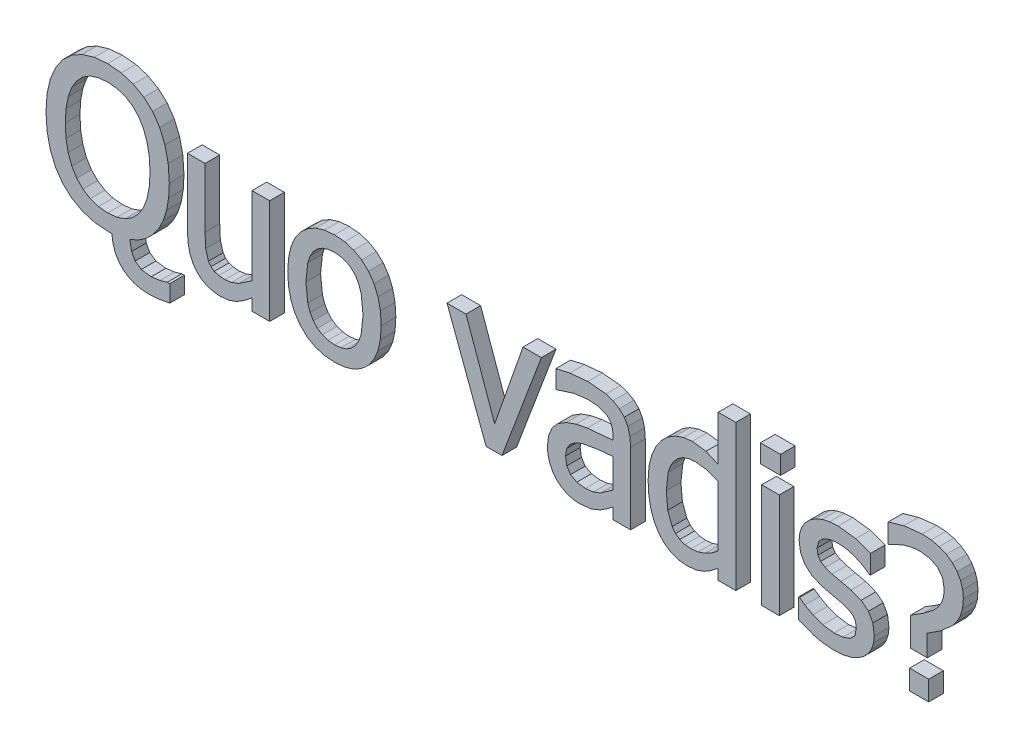
from build123d import *

# Parameters (mm, degrees)
BOSS_EXTRUDE2_DEPTH  = 21.945601329
BOSS_EXTRUDE3_DEPTH  = 21.945601329
BOSS_EXTRUDE4_DEPTH  = 21.945601329
BOSS_EXTRUDE5_DEPTH  = 21.945601329
BOSS_EXTRUDE6_DEPTH  = 21.945601329
BOSS_EXTRUDE7_DEPTH  = 21.945601329
BOSS_EXTRUDE8_DEPTH  = 21.945601329
BOSS_EXTRUDE9_DEPTH  = 21.945601329
SKETCH45_W           = 29.989480972
SKETCH45_H           = 27.32694149
BOSS_EXTRUDE10_DEPTH = 21.945601329
SKETCH50_W           = 26.345968246
SKETCH50_H           = 156.534194946
BOSS_EXTRUDE11_DEPTH = 21.945601329
SKETCH55_W           = 28.588294983
SKETCH55_H           = 29.569149017
BOSS_EXTRUDE12_DEPTH = 21.945601329


with BuildPart() as part:
    # Sketch5 → Boss-Extrude2 (new body)
    with BuildSketch(Plane.XY.offset(21.945601329)):
        Polygon((3032.252550125, 1582.424879074), (3031.341552734, 1603.095293045), (3031.341552734, 1692.223072052), (3004.995346069, 1692.223072052), (3004.995346069, 1590.623021126), (3005.923986435, 1575.978517532), (3008.709192276, 1563.7165308), (3013.175964355, 1553.591609001), (3019.149541855, 1545.358419418), (3026.454210281, 1539.052248001), (3034.914970398, 1534.707903862), (3044.251680374, 1532.185554504), (3054.183959961, 1531.344771385), (3067.006587982, 1532.728552818), (3078.568220139, 1536.880135536), (3089.814186096, 1543.694257736), (3101.690769196, 1553.066134453), (3101.690769196, 1535.688877106), (3128.036737442, 1535.688877106), (3128.036737442, 1692.223072052), (3101.690769196, 1692.223072052), (3101.690769196, 1575.3480196), (3081.650972366, 1561.894655228), (3071.035385132, 1557.795763016), (3061.050653458, 1556.429386139), (3051.889419556, 1557.130098343), (3045.14503479, 1559.232234955), (3040.187597275, 1562.84070015), (3036.386489868, 1568.06075573), align=None)
    extrude(amount=-BOSS_EXTRUDE2_DEPTH)


with BuildPart() as body_2:
    # Sketch10 → Boss-Extrude3 (new body)
    with BuildSketch(Plane.XY.offset(21.945601329)):
        Polygon((2865.330457687, 1533.289074898), (2885.457754135, 1531.4848423), (2891.904354095, 1531.4848423), (2893.432617188, 1519.993424416), (2896.616458893, 1509.903550148), (2901.455402374, 1501.215100288), (2907.950162888, 1493.927955627), (2915.819644928, 1488.164663315), (2924.784183502, 1484.048128128), (2934.843540192, 1481.578230858), (2945.997714996, 1480.754852295), (2962.603807449, 1481.735825539), (2978.509426117, 1484.67874527), (2978.509426117, 1509.903550148), (2974.725723267, 1509.903550148), (2963.794946671, 1506.750464439), (2950.621843338, 1504.998803139), (2935.837507248, 1507.030844688), (2926.658391953, 1513.406991959), (2921.403169632, 1523.286700249), (2918.670654297, 1537.370562553), (2931.677341461, 1543.125033379), (2943.229675293, 1550.999045372), (2953.328609467, 1560.992598534), (2961.973190308, 1573.105812073), (2968.901395798, 1587.163448334), (2973.849773407, 1602.990269661), (2976.819038391, 1620.586276054), (2977.808952332, 1639.951586723), (2976.162195206, 1664.580821991), (2971.222162247, 1686.33723259), (2963.304519653, 1705.010652542), (2952.72397995, 1720.390796661), (2939.621210098, 1732.337474823), (2923.855543137, 1741.27137661), (2905.707597733, 1746.841788292), (2885.457754135, 1748.698592186), (2865.435838699, 1746.894359589), (2847.410678864, 1741.481423378), (2831.627607346, 1732.600212097), (2818.331956863, 1720.390796661), (2807.663917542, 1704.695224762), (2799.763441086, 1686.197042465), (2794.876098633, 1664.685964584), (2793.246984482, 1639.951586723), (2794.858694077, 1615.637660027), (2799.693584442, 1593.986392021), (2807.541131973, 1575.277805328), (2818.191766739, 1559.792637825), (2831.487417221, 1547.58310318), (2847.27025032, 1538.701891899), align=None)
        Polygon((2885.598182678, 1555.168151855), (2871.829509735, 1556.534409523), (2859.532356262, 1560.633540154), (2848.70672226, 1567.465186119), (2839.352369308, 1577.029705048), (2831.811189651, 1589.160323143), (2826.424837112, 1603.690981865), (2823.192834854, 1620.621323586), (2822.115421295, 1639.951586723), (2823.219060898, 1659.220576286), (2826.529741287, 1676.387429237), (2831.907749176, 1691.136956215), (2839.212417603, 1703.153848648), (2848.549127579, 1712.770700455), (2859.18211937, 1719.479799271), (2871.426582336, 1723.421216011), (2885.598182678, 1724.734902382), (2899.454116821, 1723.386287689), (2911.873817444, 1719.339728355), (2922.717094421, 1712.595462799), (2931.843519211, 1703.153848648), (2939.060688019, 1691.277146339), (2944.455862045, 1676.667809486), (2947.819232941, 1659.500837326), (2948.940515518, 1639.951586723), (2947.867393494, 1620.621323586), (2944.648742676, 1603.690981865), (2939.284086227, 1589.160323143), (2931.773424149, 1577.029705048), (2922.450065613, 1567.465186119), (2911.646127701, 1560.633540154), (2899.36208725, 1556.534409523), align=None, mode=Mode.SUBTRACT)
    extrude(amount=-BOSS_EXTRUDE3_DEPTH)


with BuildPart() as body_3:
    # Sketch15 → Boss-Extrude4 (new body)
    with BuildSketch(Plane.XY.offset(21.945601329)):
        Polygon((3265.564680099, 1543.444633484), (3275.88224411, 1552.855849266), (3284.220218658, 1564.736962318), (3290.176391602, 1578.868985176), (3293.749809265, 1595.251917839), (3294.940710068, 1613.885998726), (3293.749809265, 1632.467389107), (3290.176391602, 1648.832798004), (3284.220218658, 1662.982344627), (3275.88224411, 1674.915909767), (3265.564680099, 1684.388399124), (3253.670454025, 1691.15447998), (3240.199565887, 1695.214033127), (3225.152254105, 1696.567177773), (3210.153102875, 1695.209622383), (3196.68674469, 1691.136956215), (3184.75317955, 1684.349060059), (3174.352169037, 1674.845933914), (3165.921926498, 1662.890434265), (3159.900426865, 1648.745298386), (3156.287431717, 1632.410407066), (3155.083417892, 1613.885998726), (3156.252384186, 1595.821261406), (3159.760475159, 1579.744815826), (3165.606737137, 1565.656542778), (3173.791885376, 1553.55656147), (3184.017419815, 1543.838858604), (3195.986032486, 1536.897540092), (3209.69748497, 1532.732963562), (3225.152254105, 1531.344771385), (3240.199565887, 1532.689213753), (3253.670454025, 1536.722421646), align=None)
        Polygon((3264.986515045, 1640.389561653), (3267.75431633, 1613.885998726), (3264.96887207, 1587.662696838), (3261.487483978, 1577.375650406), (3256.613254547, 1568.97175312), (3250.468969345, 1562.442183495), (3243.17741394, 1557.778120041), (3234.738349915, 1554.979801178), (3225.152254105, 1554.047107697), (3215.443372726, 1554.997444153), (3206.916809082, 1557.848215103), (3199.57280159, 1562.599778175), (3193.410873413, 1569.25201416), (3188.536643982, 1577.743530273), (3185.05525589, 1588.01305294), (3182.26981163, 1613.885998726), (3185.05525589, 1640.389561653), (3188.536643982, 1650.711536407), (3193.410873413, 1659.080386162), (3199.57280159, 1665.548682213), (3206.916809082, 1670.168757439), (3215.443372726, 1672.940969467), (3225.152254105, 1673.864841461), (3234.795570374, 1672.940969467), (3243.265151978, 1670.168757439), (3250.560998917, 1665.548682213), (3256.683349609, 1659.080386162), (3261.526823044, 1650.711536407), align=None, mode=Mode.SUBTRACT)
    extrude(amount=-BOSS_EXTRUDE4_DEPTH)


with BuildPart() as body_4:
    # Sketch20 → Boss-Extrude5 (new body)
    with BuildSketch(Plane.XY.offset(21.945601329)):
        Polygon((3393.457889557, 1692.223072052), (3452.035427094, 1535.688877106), (3475.718975067, 1535.688877106), (3534.716844559, 1692.223072052), (3507.249832153, 1692.223072052), (3464.788198471, 1571.424126625), (3421.905755997, 1692.223072052), align=None)
    extrude(amount=-BOSS_EXTRUDE5_DEPTH)


with BuildPart() as body_5:
    # Sketch25 → Boss-Extrude6 (new body)
    with BuildSketch(Plane.XY.offset(21.945601329)):
        Polygon((3642.062664032, 1535.688877106), (3668.268442154, 1535.688877106), (3668.268442154, 1642.75431633), (3667.217493057, 1656.347632408), (3664.064407349, 1667.698860168), (3658.774137497, 1676.982998848), (3651.311635971, 1684.375286102), (3641.922235489, 1689.945816994), (3631.412029266, 1693.484306335), (3604.22539711, 1696.006774902), (3577.318668365, 1693.484306335), (3556.438207626, 1688.859701157), (3556.438207626, 1662.093400955), (3557.979822159, 1662.093400955), (3582.643985748, 1670.011162758), (3604.084968567, 1672.743797302), (3619.079828262, 1671.692848206), (3631.412029266, 1667.418718338), (3635.896682739, 1663.687467575), (3639.260053635, 1658.659934998), (3641.361951828, 1652.091026306), (3642.062664032, 1643.735408783), (3642.062664032, 1638.69035244), (3603.384494781, 1635.257005692), (3586.638212204, 1632.016301155), (3572.27396965, 1626.918792725), (3559.416294098, 1619.018435478), (3550.552368164, 1608.770847321), (3545.402526855, 1596.140861511), (3543.685913086, 1581.093549728), (3544.631719589, 1570.84608078), (3547.469377518, 1561.123967171), (3551.883935928, 1552.417874336), (3557.559490204, 1545.218348503), (3564.671278, 1539.367556572), (3572.83449173, 1534.988284111), (3581.768274307, 1532.255530357), (3591.192722321, 1531.344771385), (3609.480619431, 1533.306598663), (3623.003959656, 1538.912177086), (3633.444309235, 1545.70877552), (3642.062664032, 1552.365422249), align=None)
        Polygon((3587.759017944, 1557.305335999), (3578.439950943, 1562.455296516), (3572.764396667, 1570.96862793), (3570.872545242, 1582.775235176), (3572.589159012, 1593.373298645), (3577.739238739, 1601.343512535), (3585.516929626, 1607.14173317), (3595.116376877, 1611.223340034), (3618.309259415, 1615.357398987), (3642.062664032, 1617.669701576), (3642.062664032, 1574.226856232), (3623.143911362, 1560.983896255), (3612.458467484, 1556.937456131), (3600.581645966, 1555.58848381), align=None, mode=Mode.SUBTRACT)
    extrude(amount=-BOSS_EXTRUDE6_DEPTH)


with BuildPart() as body_6:
    # Sketch30 → Boss-Extrude7 (new body)
    with BuildSketch(Plane.XY.offset(21.945601329)):
        Polygon((4015.232086182, 1663.634896278), (4025.900363922, 1656.487941742), (4027.30178833, 1656.487941742), (4027.30178833, 1684.655666351), (4005.159854889, 1692.783474922), (3978.954076767, 1696.006774902), (3966.368198395, 1695.174694061), (3955.095767975, 1692.678570747), (3945.137023926, 1688.518047333), (3936.492204666, 1682.693600655), (3929.50296402, 1675.546526909), (3924.510478973, 1667.418718338), (3921.515226364, 1658.309578896), (3920.516729355, 1648.219704628), (3922.548532486, 1633.943200111), (3928.644657135, 1621.943831444), (3939.225196838, 1612.502098083), (3954.710483551, 1605.898141861), (3969.705104828, 1602.254509926), (3982.87820816, 1599.311470985), (3993.931293488, 1595.703005791), (4001.026153564, 1591.32373333), (4004.861831665, 1585.402846336), (4006.14118576, 1577.169775963), (4003.968715668, 1566.238999367), (3996.891736984, 1559.37230587), (3986.241340637, 1555.658578873), (3972.788095474, 1554.187178612), (3956.041574478, 1556.569576263), (3941.256999969, 1562.034964561), (3929.135084152, 1568.761467934), (3921.217441559, 1574.647426605), (3919.816017151, 1574.647426605), (3919.816017151, 1545.078277588), (3942.448139191, 1536.10932827), (3956.619501114, 1532.956242561), (3971.80724144, 1531.905174255), (3986.433982849, 1532.816171646), (3998.363256454, 1535.54880619), (4008.400440216, 1540.033221245), (4017.352104187, 1546.199321747), (4024.131298065, 1553.293704987), (4029.053211212, 1561.684608459), (4032.049179077, 1570.986151695), (4033.047676086, 1580.813407898), (4030.858039856, 1596.368670464), (4024.289131165, 1608.280301094), (4013.375759125, 1616.933941841), (3998.152971268, 1622.71463871), (3982.948064804, 1626.148104668), (3969.845294952, 1629.160881042), (3959.685087204, 1632.681846619), (3952.748298645, 1637.078762054), (3948.754549026, 1643.157243729), (3947.422981262, 1651.723146439), (3949.665307999, 1661.392688751), (3956.391811371, 1668.259382248), (3966.376543045, 1672.358512878), (3978.393554688, 1673.724770546), (3990.953445435, 1672.568678856), (4003.408432007, 1669.100284576), align=None)
    extrude(amount=-BOSS_EXTRUDE7_DEPTH)


with BuildPart() as body_7:
    # Sketch35 → Boss-Extrude8 (new body)
    with BuildSketch(Plane.XY.offset(21.945601329)):
        Polygon((4053.787708282, 1710.160732269), (4055.329322815, 1710.160732269), (4075.438976288, 1719.900250435), (4088.244438171, 1723.421216011), (4101.855278015, 1724.594831467), (4116.324424744, 1722.650408745), (4127.780914307, 1716.817140579), (4135.242938995, 1707.025170326), (4137.73059845, 1693.204045296), (4136.679172516, 1682.991504669), (4133.526325226, 1673.935055733), (4128.481388092, 1665.789484978), (4121.754646301, 1658.309578896), (4105.428695679, 1645.907402039), (4087.141036987, 1634.486198425), (4087.141036987, 1591.744065285), (4112.225532532, 1591.744065285), (4112.225532532, 1623.695492744), (4132.475376129, 1637.008666992), (4149.641990662, 1652.003526688), (4156.45647049, 1660.779595375), (4161.764144897, 1670.852065086), (4165.180206299, 1682.325720787), (4166.318893433, 1695.306062698), (4165.285110474, 1706.705451012), (4162.184238434, 1716.939806938), (4157.01675415, 1726.009368896), (4149.782180786, 1733.914017677), (4140.752315521, 1740.321040154), (4130.198001862, 1744.89736557), (4118.119716644, 1747.643113136), (4104.517936707, 1748.558521271), (4077.470779419, 1745.545506477), (4053.787708282, 1738.748788834), align=None)
    extrude(amount=-BOSS_EXTRUDE8_DEPTH)


with BuildPart() as body_8:
    # Sketch40 → Boss-Extrude9 (new body)
    with BuildSketch(Plane.XY.offset(21.945601329)):
        Polygon((3766.6451931, 1532.816171646), (3778.2766819, 1536.950230598), (3788.786888123, 1543.1163311), (3799.437522888, 1551.664710045), (3799.437522888, 1535.688877106), (3825.783491135, 1535.688877106), (3825.783491135, 1753.743648529), (3799.437522888, 1753.743648529), (3799.437522888, 1685.916781425), (3781.079292297, 1693.974733353), (3760.619163513, 1696.567177773), (3747.604131699, 1695.113420486), (3735.184431076, 1690.751671791), (3723.955631256, 1683.832287788), (3714.513778687, 1674.705862999), (3706.140756607, 1662.531256676), (3699.799537659, 1648.429870605), (3695.805311203, 1631.981253624), (3694.474220276, 1612.764835358), (3695.525169373, 1594.143986702), (3698.678255081, 1577.800393105), (3703.758239746, 1563.804149628), (3710.589885712, 1552.225232124), (3718.980789185, 1543.221473694), (3729.018211365, 1536.669969559), (3740.351915359, 1532.675981522), (3752.631425858, 1531.344771385), align=None)
        Polygon((3789.873123169, 1566.642045975), (3779.678106308, 1561.123967171), (3769.202470779, 1557.603001595), (3758.797645569, 1556.429386139), (3749.723434448, 1557.344675064), (3741.980791092, 1560.09054184), (3735.5697155, 1564.666867256), (3730.489492416, 1571.073770523), (3723.868131638, 1588.958859444), (3721.661090851, 1613.325357437), (3724.53379631, 1638.672828674), (3728.12461853, 1648.810863495), (3733.152151108, 1657.258629799), (3739.449739456, 1663.910865784), (3746.85049057, 1668.662428856), (3755.355119705, 1671.513199806), (3764.963626862, 1672.463536263), (3781.850337982, 1670.6417799), (3799.437522888, 1664.055347443), (3799.437522888, 1573.806405067), align=None, mode=Mode.SUBTRACT)
    extrude(amount=-BOSS_EXTRUDE9_DEPTH)


with BuildPart() as body_9:
    # Sketch45 → Boss-Extrude10 (new body)
    with BuildSketch(Plane.XY.offset(21.945601329)):
        with Locations((3877.63440609, 1732.092320919)):
            Rectangle(SKETCH45_W, SKETCH45_H)
    extrude(amount=-BOSS_EXTRUDE10_DEPTH)


with BuildPart() as body_10:
    # Sketch50 → Boss-Extrude11 (new body)
    with BuildSketch(Plane.XY.offset(21.945601329)):
        with Locations((3877.63440609, 1613.955974579)):
            Rectangle(SKETCH50_W, SKETCH50_H)
    extrude(amount=-BOSS_EXTRUDE11_DEPTH)


with BuildPart() as body_11:
    # Sketch55 → Boss-Extrude12 (new body)
    with BuildSketch(Plane.XY.offset(21.945601329)):
        with Locations((4100.173473358, 1550.473451614)):
            Rectangle(SKETCH55_W, SKETCH55_H)
    extrude(amount=-BOSS_EXTRUDE12_DEPTH)


solid = Compound([part.part, body_2.part, body_3.part, body_4.part, body_5.part, body_6.part, body_7.part, body_8.part, body_9.part, body_10.part, body_11.part])
